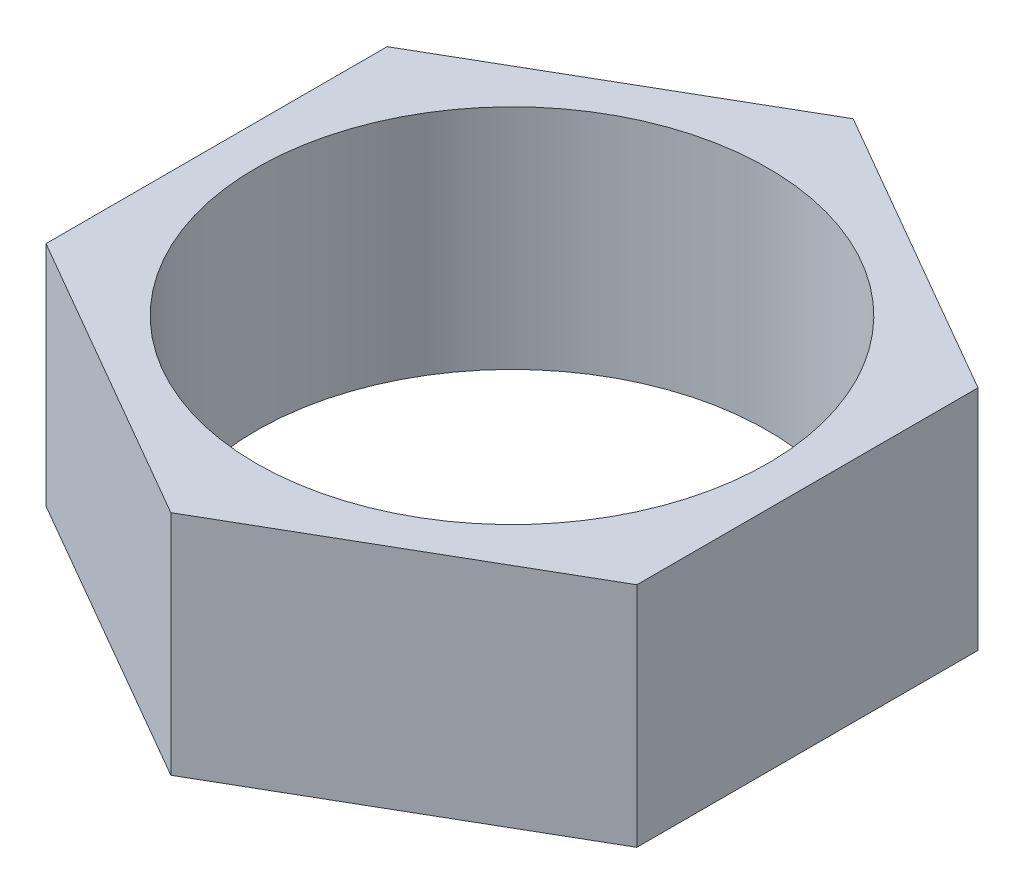
from build123d import *

# Parameters (mm, degrees)
SKETCH1_R           = 2.25
BOSS_EXTRUDE1_DEPTH = 2


with BuildPart() as part:
    # Sketch1 → Boss-Extrude1 (new body)
    with BuildSketch(Plane(origin=(0, 0, 0), x_dir=(1, 0, 0), z_dir=(0, 1, 0))):
        Polygon((0, 3), (-2.598076211, 1.5), (-2.598076211, -1.5), (0, -3), (2.598076211, -1.5), (2.598076211, 1.5), align=None)
        Circle(SKETCH1_R, mode=Mode.SUBTRACT)
    extrude(amount=BOSS_EXTRUDE1_DEPTH)


solid = part.part
